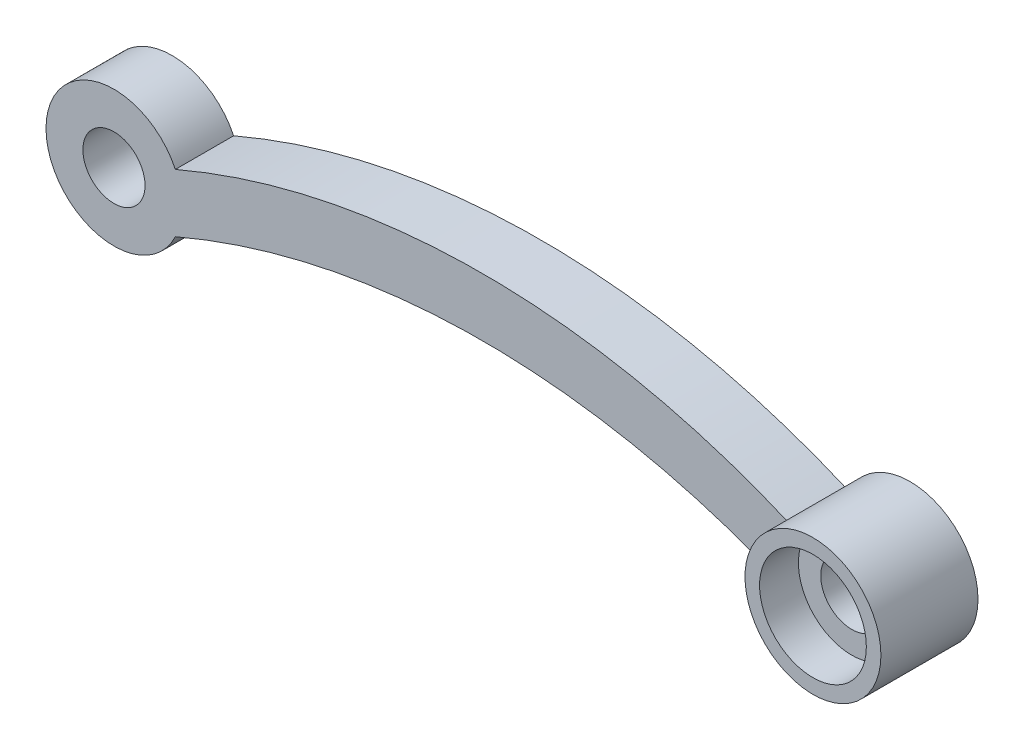
from build123d import *

# Parameters (mm, degrees)
SKETCH2_R           = 1.6
BOSS_EXTRUDE1_DEPTH = 3
SKETCH3_R           = 3.5
SKETCH3_R_2         = 2.75
BOSS_EXTRUDE2_DEPTH = 2


with BuildPart() as part:
    # Sketch2 → Boss-Extrude1 (new body)
    with BuildSketch(Plane.XY):
        with BuildLine():
            ThreePointArc((-15.83772234, 1.5), (-22.5, 0), (-15.83772234, -1.5))
            ThreePointArc((-15.83772234, -1.5), (0, 1.768997412), (15.83772234, -1.5))
            ThreePointArc((15.83772234, -1.5), (22.5, 0), (15.83772234, 1.5))
            ThreePointArc((15.83772234, 1.5), (0, 4.768997412), (-15.83772234, 1.5))
        make_face()
        with Locations((-19, 0)):
            Circle(SKETCH2_R, mode=Mode.SUBTRACT)
        with Locations((19, 0)):
            Circle(SKETCH2_R, mode=Mode.SUBTRACT)
    extrude(amount=BOSS_EXTRUDE1_DEPTH)

    # Sketch3 → Boss-Extrude2 (add)
    with BuildSketch(Plane.XY.offset(3)):
        with Locations(Location((19, 0, 0), (0, 0, 154.623066475))):
            Circle(SKETCH3_R)
        with Locations((19, 0)):
            Circle(SKETCH3_R_2, mode=Mode.SUBTRACT)
    extrude(amount=BOSS_EXTRUDE2_DEPTH)


solid = part.part
